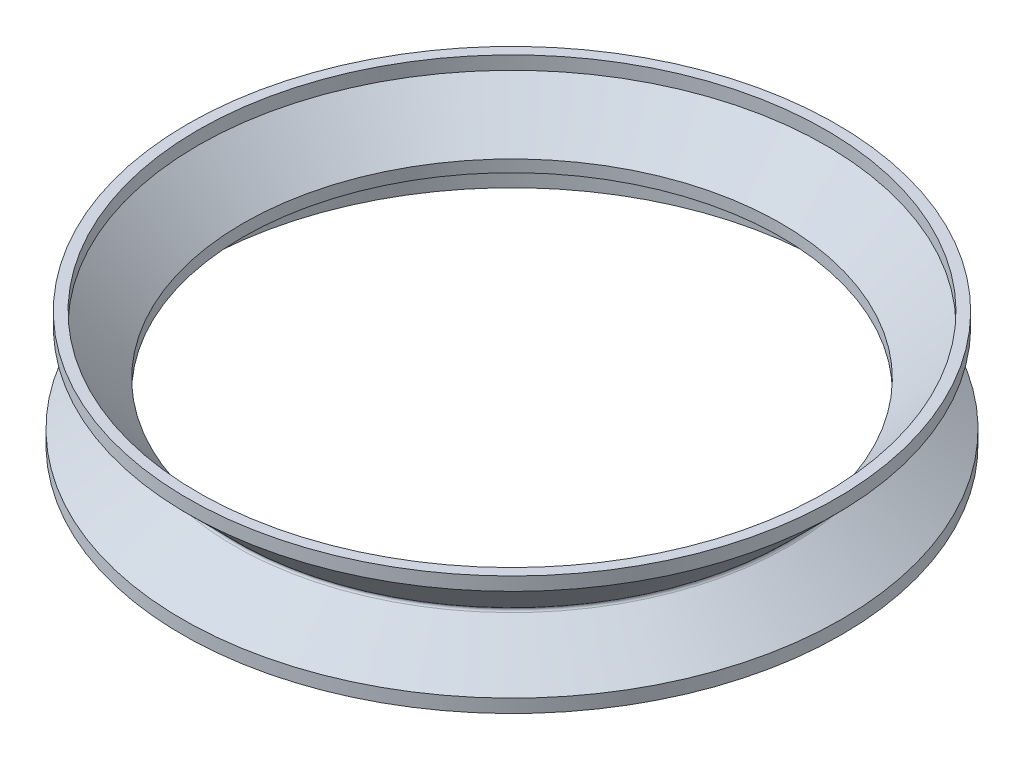
from build123d import *

# Parameters (mm, degrees)
FILLET2_R           = 0.4
SKETCH2_R           = 48.615634919
SKETCH2_R_2         = 47.06
BOSS_EXTRUDE1_DEPTH = 2
SKETCH3_R           = 49.398893358
SKETCH3_R_2         = 47.132412523
BOSS_EXTRUDE2_DEPTH = 2


with BuildPart() as part:
    # Sketch1 → Revolve1 (revolve)
    with BuildSketch(Plane.XY):
        Polygon((0.662781953, 0), (-6.837218047, 7.5), (-5.281583129, 7.5), (1.462781953, 0.755634919), (1.462781953, -1.026840935), (-5.353995652, -5.8), (-7.620476486, -5.8), align=None)
    revolve(axis=Axis((41.778416871, 7.109018033, 0), (0, -1, 0)))

    # Fillet2
    fillet2_edges = [part.edges().sort_by_distance(p)[0] for p in [
        (82.89405179, 0, 0),
    ]]
    fillet(fillet2_edges, radius=FILLET2_R)

    # Sketch2 → Boss-Extrude1 (add)
    with BuildSketch(Plane(origin=(0, 7.5, 0), x_dir=(1, 0, 0), z_dir=(0, 1, 0))):
        with Locations(Location((41.778416871, 0, 0), (0, 0, 180))):
            Circle(SKETCH2_R)
        with Locations(Location((41.778416871, 0, 0), (0, 0, 180))):
            Circle(SKETCH2_R_2, mode=Mode.SUBTRACT)
    extrude(amount=BOSS_EXTRUDE1_DEPTH)

    # Sketch3 → Boss-Extrude2 (add)
    with BuildSketch(Plane.XZ.offset(5.8)):
        with Locations((41.778416871, 0)):
            Circle(SKETCH3_R)
        with Locations(Location((41.778416871, 0, 0), (0, 0, 180))):
            Circle(SKETCH3_R_2, mode=Mode.SUBTRACT)
    extrude(amount=BOSS_EXTRUDE2_DEPTH)


solid = part.part
